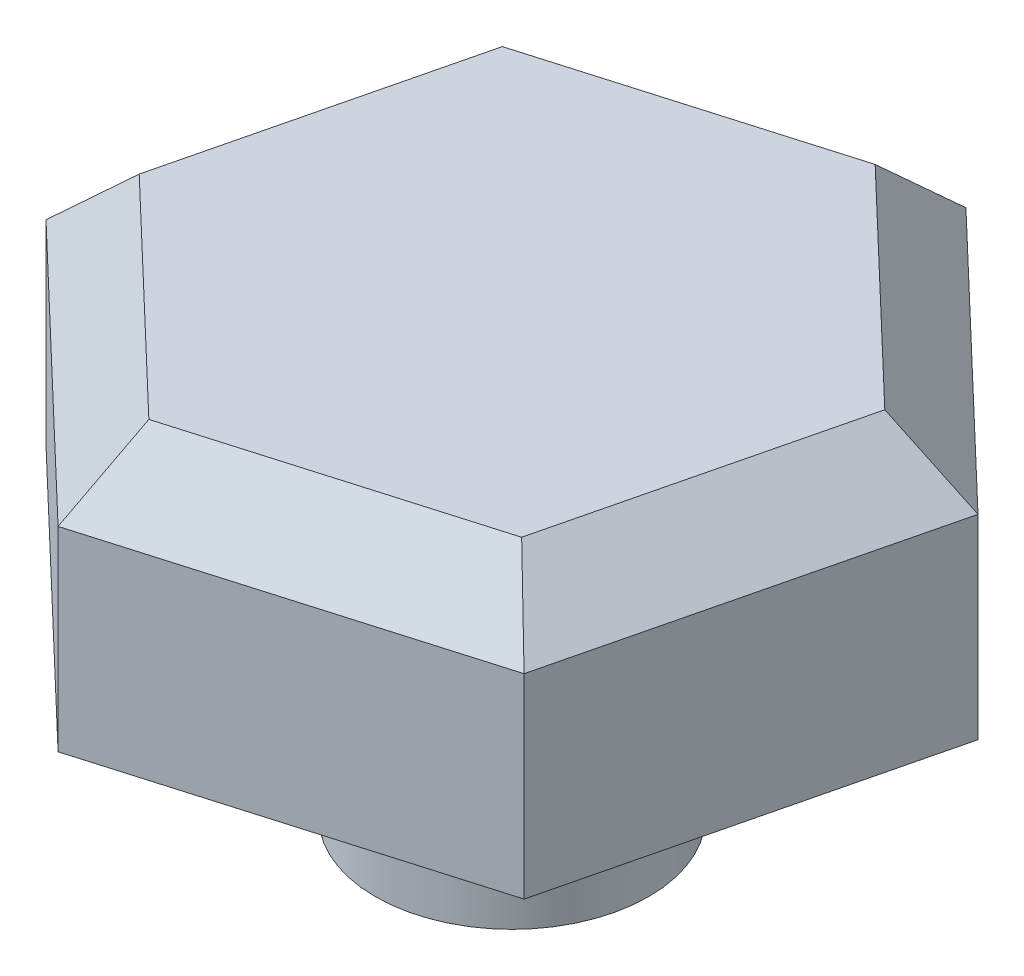
from build123d import *

# Parameters (mm, degrees)
EXTRUDE_1_DEPTH = 4
CHAMFER_1_SIZE  = 1
SKETCH_2_R      = 2.1
EXTRUDE_2_DEPTH = 3


with BuildPart() as part:
    # 草图1 → 拉伸1 (new body)
    with BuildSketch(Plane(origin=(0, 0, 0), x_dir=(1, 0, 0), z_dir=(0, 1, 0))):
        Polygon((4.174188702, -3.988669204), (5.541383209, 1.620618854), (1.367194507, 5.609288058), (-4.174188702, 3.988669204), (-5.541383209, -1.620618854), (-1.367194507, -5.609288058), align=None)
    extrude(amount=EXTRUDE_1_DEPTH)

    # 倒角1
    chamfer_1_edges = [part.edges().sort_by_distance(p)[0] for p in [
        (3.454288858, 4, -3.614953456),
        (-1.403497097, 4, -4.798978631),
        (-4.857785955, 4, -1.184025175),
        (-3.454288858, 4, 3.614953456),
        (1.403497097, 4, 4.798978631),
        (4.857785955, 4, 1.184025175),
    ]]
    chamfer(chamfer_1_edges, length=CHAMFER_1_SIZE)

    # 草图2 → 拉伸2 (add)
    with BuildSketch(Plane.XZ):
        with Locations(Location((0, 0, 0), (0, 0, 90))):
            Circle(SKETCH_2_R)
    extrude(amount=EXTRUDE_2_DEPTH)


solid = part.part
